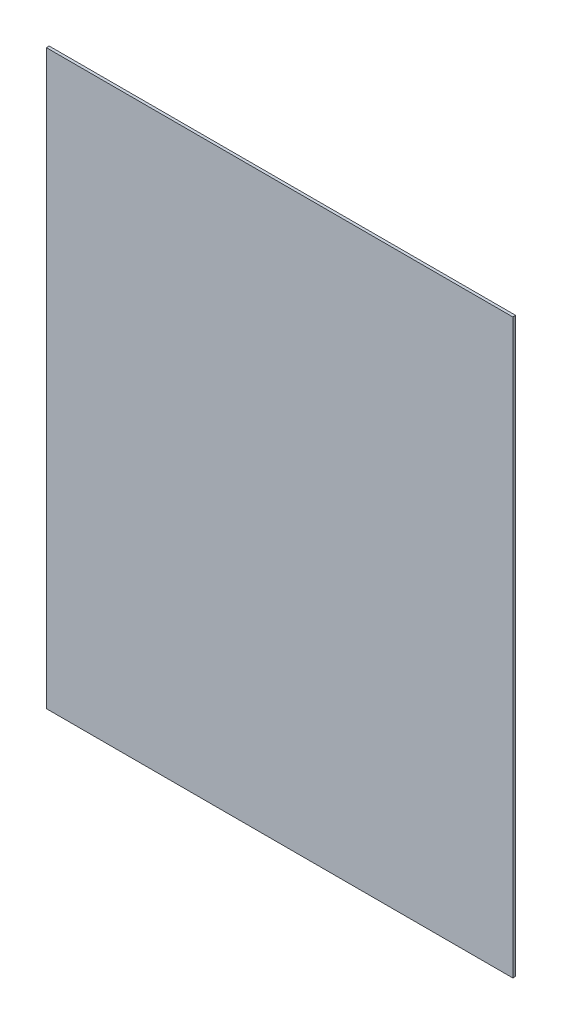
from build123d import *

# Parameters (mm, degrees)
SKETCH1_W               = 1.65
SKETCH1_H               = 2.025
COMPONENT_OUTLINE_DEPTH = 0.01


with BuildPart() as part:
    # Sketch1 → Component_Outline (new body)
    with BuildSketch(Plane.XY):
        with Locations((0, 0.0125)):
            Rectangle(SKETCH1_W, SKETCH1_H)
    extrude(amount=COMPONENT_OUTLINE_DEPTH)


solid = part.part
